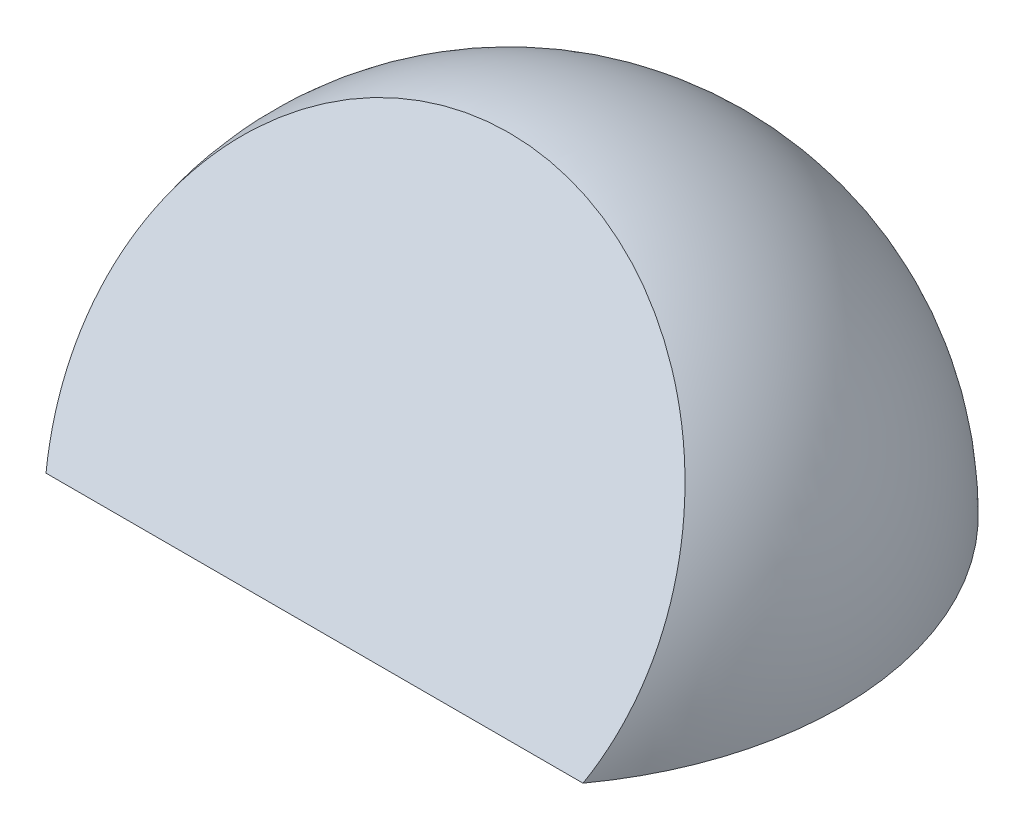
from build123d import *

# Parameters (mm, degrees)
R_VOLUTION1_ANGLE            = 180
COQUE4_T                     = -4
ENL_V_MAT_EXTRU_4_DEPTH      = 215
ENL_V_MAT_EXTRU_4_DEPTH_BACK = 215
BOSS_EXTRU_2_DEPTH           = 4
ENL_V_MAT_EXTRU_5_DEPTH      = 116
ENL_V_MAT_EXTRU_5_DEPTH_BACK = 116


with BuildPart() as part:
    # Esquisse3 → Révolution1 (revolve)
    with BuildSketch(Plane(origin=(0, 0, 0), x_dir=(1, 0, 0), z_dir=(0, 1, 0))):
        with BuildLine():
            Line((-99.218538531, -45.831289244), (92.520591904, -45.831289244))
            Line((92.520591904, -45.831289244), (101.651026687, -45.831289244))
            ThreePointArc((101.651026687, -45.831289244), (-3.348973313, 59.168710756), (-108.348973313, -45.831289244))
            Line((-108.348973313, -45.831289244), (-99.218538531, -45.831289244))
        make_face()
    revolve(axis=Axis((-99.218538531, 0, 45.831289244), (1, 0, 0)), revolution_arc=R_VOLUTION1_ANGLE)

    # Coque4
    coque4_openings = [part.faces().sort_by_distance(p)[0] for p in [
        (-3.348973313, 0, 45.831289244),
    ]]
    offset(amount=COQUE4_T, openings=coque4_openings)

    # Esquisse8 → Enlèv. mat.-Extru.4 (cut, two sides: drawn at the far end of the back side and taken through both)
    with BuildSketch(Plane(origin=(60.188697083, -79.696891645, -906.524570727), x_dir=(0, 0, -1), z_dir=(1, 0, 0)).offset(-ENL_V_MAT_EXTRU_4_DEPTH_BACK)):
        Polygon((-1014, 79.696891645), (-952.35585997, 184.696891645), (-1018.029052905, 190.459065972), (-1080.678095687, 148.38135067), (-1080.678095687, 69.088233835), align=None)
    extrude(amount=ENL_V_MAT_EXTRU_4_DEPTH + ENL_V_MAT_EXTRU_4_DEPTH_BACK, mode=Mode.SUBTRACT)

    # Esquisse9 → Boss.-Extru.2 (add)
    with BuildSketch(Plane(origin=(0, 46.924060253, 79.926921264), x_dir=(1, 0, 0), z_dir=(0, 0.5062842851630452, 0.8623666404708291))):
        with BuildLine():
            Line((-88.348973313, -54.413120882), (81.651026687, -54.413120882))
            ThreePointArc((81.651026687, -54.413120882), (-3.348973313, 67.344835737), (-88.348973313, -54.413120882))
        make_face()
    extrude(amount=-BOSS_EXTRU_2_DEPTH)

    # Esquisse12 → Enlèv. mat.-Extru.5 (cut, two sides: drawn at the far end of the back side and taken through both)
    with BuildSketch(Plane(origin=(0, 0, 0), x_dir=(0, 0, -1), z_dir=(1, 0, 0)).offset(-ENL_V_MAT_EXTRU_5_DEPTH_BACK)):
        Polygon((-107.475429273, 0), (-102.191678846, 0), (-103.675762979, -3.693901999), align=None)
    extrude(amount=ENL_V_MAT_EXTRU_5_DEPTH + ENL_V_MAT_EXTRU_5_DEPTH_BACK, mode=Mode.SUBTRACT)


solid = part.part
